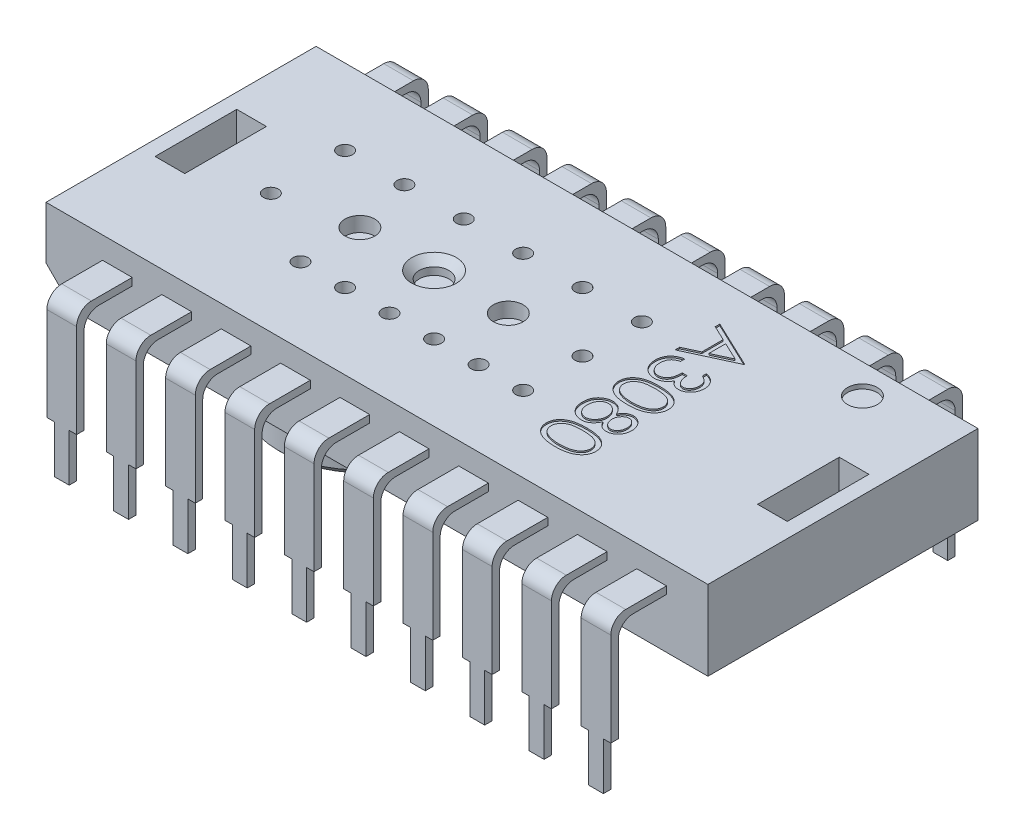
from build123d import *

# Parameters (mm, degrees)
SKETCH1_W           = 22.3
SKETCH1_H           = 9.1
BOSS_EXTRUDE1_DEPTH = 3.18
SKETCH2_R           = 2.8
SKETCH2_R_2         = 0.525
BOSS_EXTRUDE2_DEPTH = 2.25
BOSS_EXTRUDE2_DRAFT = 1.5
CHAMFER1_SIZE       = 0.3
CHAMFER1_SIZE2      = 0.308172622
SKETCH3_W           = 1
SKETCH3_H           = 1.875
BOSS_EXTRUDE3_DEPTH = 0.25
BOSS_EXTRUDE4_DEPTH = 0.25
BOSS_EXTRUDE5_DEPTH = 0.25
FILLET1_R           = 0.5
CUT_EXTRUDE1_DEPTH  = 27.146980705
SKETCH8_W           = 22.3
SKETCH8_H           = 9.1
SKETCH8_W_2         = 19.48
SKETCH8_H_2         = 7.28
CUT_EXTRUDE2_DEPTH  = 0.5
CHAMFER2_SIZE       = 0.91
CUT_EXTRUDE3_DEPTH  = 0.5
SKETCH11_R          = 0.5
CUT_EXTRUDE5_DEPTH  = 0.15
SKETCH13_R          = 0.5
SKETCH13_R_2        = 0.25
CUT_EXTRUDE6_DEPTH  = 0.5
CHAMFER3_SIZE       = 0.25
SKETCH14_W          = 1
SKETCH14_H          = 2.75
CUT_EXTRUDE7_DEPTH  = 1
CUT_EXTRUDE8_DEPTH  = 0.05
SKETCH16_W          = 19.5
SKETCH16_H          = 1.8
CUT_EXTRUDE9_DEPTH  = 27.146980791


with BuildPart() as part:
    # Sketch1 → Boss-Extrude1 (new body)
    with BuildSketch(Plane(origin=(0, 0, 0), x_dir=(1, 0, 0), z_dir=(0, 1, 0))):
        with Locations((11.15, 4.55)):
            Rectangle(SKETCH1_W, SKETCH1_H)
    extrude(amount=BOSS_EXTRUDE1_DEPTH)


with BuildPart() as boss_extrude2_tool:
    # Sketch2 → Boss-Extrude2 (with draft: the straight prism first)
    with BuildSketch(Plane(origin=(0, 0, 0), x_dir=(-1, 0, 0), z_dir=(0, -1, 0))):
        with Locations((-6.025, 4.55)):
            Circle(SKETCH2_R)
        with Locations((-6.025, 4.55)):
            Circle(SKETCH2_R_2, mode=Mode.SUBTRACT)
    extrude(amount=BOSS_EXTRUDE2_DEPTH)
    # Boss-Extrude2: the draft: its side faces are tilted about the plane it starts from
    boss_extrude2_sides = [boss_extrude2_tool.faces().sort_by_distance(p)[0] for p in [
        (8.825, -1.125, -4.55),
        (6.55, -1.125, -4.55),
    ]]
    draft(boss_extrude2_sides, Plane(origin=(0, 0, 0), x_dir=(-1, 0, 0), z_dir=(0, -1, 0)), BOSS_EXTRUDE2_DRAFT)


with BuildPart() as part_1:
    add(part.part)

    # Boss-Extrude2: add boss_extrude2_tool
    add(boss_extrude2_tool.part)

    # Chamfer1
    chamfer1_edges = [part_1.edges().sort_by_distance(p)[0] for p in [
        (8.766081676, -2.25, -4.55),
    ]]
    chamfer1_side = [part_1.faces().sort_by_distance(p)[0] for p in [
        (8.795540838, -1.125, -4.55),
    ]]
    chamfer(chamfer1_edges, length=CHAMFER1_SIZE, length2=CHAMFER1_SIZE2, reference=chamfer1_side[0])

    # Sketch3 → Boss-Extrude3 (add)
    with BuildSketch(Plane(origin=(0, 2.19, 0), x_dir=(1, 0, 0), z_dir=(0, 1, 0))):
        with Locations((19.405, 10.0375)):
            Rectangle(SKETCH3_W, SKETCH3_H)
        with Locations((17.405, 10.0375)):
            Rectangle(SKETCH3_W, SKETCH3_H)
        with Locations((15.405, 10.0375)):
            Rectangle(SKETCH3_W, SKETCH3_H)
        with Locations((13.405, 10.0375)):
            Rectangle(SKETCH3_W, SKETCH3_H)
        with Locations((11.405, 10.0375)):
            Rectangle(SKETCH3_W, SKETCH3_H)
        with Locations((9.405, 10.0375)):
            Rectangle(SKETCH3_W, SKETCH3_H)
        with Locations((7.405, 10.0375)):
            Rectangle(SKETCH3_W, SKETCH3_H)
        with Locations((5.405, 10.0375)):
            Rectangle(SKETCH3_W, SKETCH3_H)
        with Locations((3.405, 10.0375)):
            Rectangle(SKETCH3_W, SKETCH3_H)
        with Locations((1.405, 10.0375)):
            Rectangle(SKETCH3_W, SKETCH3_H)
        with Locations((20.405, -0.9375)):
            Rectangle(SKETCH3_W, SKETCH3_H)
        with Locations((18.405, -0.9375)):
            Rectangle(SKETCH3_W, SKETCH3_H)
        with Locations((16.405, -0.9375)):
            Rectangle(SKETCH3_W, SKETCH3_H)
        with Locations((14.405, -0.9375)):
            Rectangle(SKETCH3_W, SKETCH3_H)
        with Locations((12.405, -0.9375)):
            Rectangle(SKETCH3_W, SKETCH3_H)
        with Locations((10.405, -0.9375)):
            Rectangle(SKETCH3_W, SKETCH3_H)
        with Locations((8.405, -0.9375)):
            Rectangle(SKETCH3_W, SKETCH3_H)
        with Locations((6.405, -0.9375)):
            Rectangle(SKETCH3_W, SKETCH3_H)
        with Locations((4.405, -0.9375)):
            Rectangle(SKETCH3_W, SKETCH3_H)
        with Locations((2.405, -0.9375)):
            Rectangle(SKETCH3_W, SKETCH3_H)
    extrude(amount=BOSS_EXTRUDE3_DEPTH)

    # Sketch5 → Boss-Extrude4 (add)
    with BuildSketch(Plane.XY.offset(1.875)):
        Polygon((1.905, 2.19), (2.905, 2.19), (2.905, -1.21), (2.655, -1.21), (2.655, -4.61), (2.155, -4.61), (2.155, -1.21), (1.905, -1.21), align=None)
        Polygon((3.905, 2.19), (4.905, 2.19), (4.905, -1.21), (4.655, -1.21), (4.655, -4.61), (4.155, -4.61), (4.155, -1.21), (3.905, -1.21), align=None)
        Polygon((5.905, 2.19), (6.905, 2.19), (6.905, -1.21), (6.655, -1.21), (6.655, -4.61), (6.155, -4.61), (6.155, -1.21), (5.905, -1.21), align=None)
        Polygon((7.905, 2.19), (8.905, 2.19), (8.905, -1.21), (8.655, -1.21), (8.655, -4.61), (8.155, -4.61), (8.155, -1.21), (7.905, -1.21), align=None)
        Polygon((9.905, 2.19), (10.905, 2.19), (10.905, -1.21), (10.655, -1.21), (10.655, -4.61), (10.155, -4.61), (10.155, -1.21), (9.905, -1.21), align=None)
        Polygon((11.905, 2.19), (12.905, 2.19), (12.905, -1.21), (12.655, -1.21), (12.655, -4.61), (12.155, -4.61), (12.155, -1.21), (11.905, -1.21), align=None)
        Polygon((13.905, 2.19), (14.905, 2.19), (14.905, -1.21), (14.655, -1.21), (14.655, -4.61), (14.155, -4.61), (14.155, -1.21), (13.905, -1.21), align=None)
        Polygon((15.905, 2.19), (16.905, 2.19), (16.905, -1.21), (16.655, -1.21), (16.655, -4.61), (16.155, -4.61), (16.155, -1.21), (15.905, -1.21), align=None)
        Polygon((17.905, 2.19), (18.905, 2.19), (18.905, -1.21), (18.655, -1.21), (18.655, -4.61), (18.155, -4.61), (18.155, -1.21), (17.905, -1.21), align=None)
        Polygon((19.905, 2.19), (20.905, 2.19), (20.905, -1.21), (20.655, -1.21), (20.655, -4.61), (20.155, -4.61), (20.155, -1.21), (19.905, -1.21), align=None)
    extrude(amount=-BOSS_EXTRUDE4_DEPTH)

    # Sketch6 → Boss-Extrude5 (add)
    with BuildSketch(Plane(origin=(0, 0, -10.975), x_dir=(-1, 0, 0), z_dir=(0, 0, -1))):
        Polygon((-19.905, 2.19), (-19.905, -1.21), (-19.655, -1.21), (-19.655, -4.61), (-19.155, -4.61), (-19.155, -1.21), (-18.905, -1.21), (-18.905, 2.19), align=None)
        Polygon((-17.905, 2.19), (-17.905, -1.21), (-17.655, -1.21), (-17.655, -4.61), (-17.155, -4.61), (-17.155, -1.21), (-16.905, -1.21), (-16.905, 2.19), align=None)
        Polygon((-15.905, 2.19), (-15.905, -1.21), (-15.655, -1.21), (-15.655, -4.61), (-15.155, -4.61), (-15.155, -1.21), (-14.905, -1.21), (-14.905, 2.19), align=None)
        Polygon((-13.905, 2.19), (-13.905, -1.21), (-13.655, -1.21), (-13.655, -4.61), (-13.155, -4.61), (-13.155, -1.21), (-12.905, -1.21), (-12.905, 2.19), align=None)
        Polygon((-11.905, 2.19), (-11.905, -1.21), (-11.655, -1.21), (-11.655, -4.61), (-11.155, -4.61), (-11.155, -1.21), (-10.905, -1.21), (-10.905, 2.19), align=None)
        Polygon((-9.905, 2.19), (-9.905, -1.21), (-9.655, -1.21), (-9.655, -4.61), (-9.155, -4.61), (-9.155, -1.21), (-8.905, -1.21), (-8.905, 2.19), align=None)
        Polygon((-7.905, 2.19), (-7.905, -1.21), (-7.655, -1.21), (-7.655, -4.61), (-7.155, -4.61), (-7.155, -1.21), (-6.905, -1.21), (-6.905, 2.19), align=None)
        Polygon((-5.905, 2.19), (-5.905, -1.21), (-5.655, -1.21), (-5.655, -4.61), (-5.155, -4.61), (-5.155, -1.21), (-4.905, -1.21), (-4.905, 2.19), align=None)
        Polygon((-3.905, 2.19), (-3.905, -1.21), (-3.655, -1.21), (-3.655, -4.61), (-3.155, -4.61), (-3.155, -1.21), (-2.905, -1.21), (-2.905, 2.19), align=None)
        Polygon((-1.905, 2.19), (-1.905, -1.21), (-1.655, -1.21), (-1.655, -4.61), (-1.155, -4.61), (-1.155, -1.21), (-0.905, -1.21), (-0.905, 2.19), align=None)
    extrude(amount=-BOSS_EXTRUDE5_DEPTH)

    # Fillet1
    fillet1_edges = [part_1.edges().sort_by_distance(p)[0] for p in [
        (7.405, 2.44, -10.975),
        (5.405, 2.44, -10.975),
        (3.405, 2.44, -10.975),
        (1.405, 2.44, -10.975),
        (18.405, 2.44, 1.875),
        (16.405, 2.44, 1.875),
        (14.405, 2.44, 1.875),
        (12.405, 2.44, 1.875),
        (10.405, 2.44, 1.875),
        (8.405, 2.44, 1.875),
        (6.405, 2.44, 1.875),
        (4.405, 2.44, 1.875),
        (2.405, 2.44, 1.875),
        (2.405, 2.19, 1.625),
        (4.405, 2.19, 1.625),
        (6.405, 2.19, 1.625),
        (19.405, 2.44, -10.975),
        (8.405, 2.19, 1.625),
        (10.405, 2.19, 1.625),
        (12.405, 2.19, 1.625),
        (14.405, 2.19, 1.625),
        (16.405, 2.19, 1.625),
        (18.405, 2.19, 1.625),
        (20.405, 2.44, 1.875),
        (20.405, 2.19, 1.625),
        (19.405, 2.19, -10.725),
        (17.405, 2.19, -10.725),
        (17.405, 2.44, -10.975),
        (15.405, 2.19, -10.725),
        (13.405, 2.19, -10.725),
        (11.405, 2.19, -10.725),
        (9.405, 2.19, -10.725),
        (7.405, 2.19, -10.725),
        (5.405, 2.19, -10.725),
        (15.405, 2.44, -10.975),
        (3.405, 2.19, -10.725),
        (1.405, 2.19, -10.725),
        (13.405, 2.44, -10.975),
        (11.405, 2.44, -10.975),
        (9.405, 2.44, -10.975),
    ]]
    fillet(fillet1_edges, radius=FILLET1_R)

    # Sketch7 → Cut-Extrude1 (cut, through all)
    with BuildSketch(Plane.XY.offset(-10.975)):
        Polygon((1.53, -4.61), (1.655, -3.61), (1.655, -4.61), align=None)
        Polygon((1.28, -4.61), (1.155, -3.61), (1.155, -4.61), align=None)
        Polygon((2.53, -4.61), (2.655, -3.61), (2.655, -4.61), align=None)
        Polygon((2.28, -4.61), (2.155, -3.61), (2.155, -4.61), align=None)
        Polygon((3.53, -4.61), (3.655, -3.61), (3.655, -4.61), align=None)
        Polygon((3.28, -4.61), (3.155, -3.61), (3.155, -4.61), align=None)
        Polygon((4.53, -4.61), (4.655, -3.61), (4.655, -4.61), align=None)
        Polygon((4.28, -4.61), (4.155, -3.61), (4.155, -4.61), align=None)
        Polygon((5.53, -4.61), (5.655, -3.61), (5.655, -4.61), align=None)
        Polygon((5.28, -4.61), (5.155, -3.61), (5.155, -4.61), align=None)
        Polygon((6.53, -4.61), (6.655, -3.61), (6.655, -4.61), align=None)
        Polygon((6.28, -4.61), (6.155, -3.61), (6.155, -4.61), align=None)
        Polygon((7.53, -4.61), (7.655, -3.61), (7.655, -4.61), align=None)
        Polygon((7.28, -4.61), (7.155, -3.61), (7.155, -4.61), align=None)
        Polygon((8.53, -4.61), (8.655, -3.61), (8.655, -4.61), align=None)
        Polygon((8.28, -4.61), (8.155, -3.61), (8.155, -4.61), align=None)
        Polygon((9.53, -4.61), (9.655, -3.61), (9.655, -4.61), align=None)
        Polygon((9.28, -4.61), (9.155, -3.61), (9.155, -4.61), align=None)
        Polygon((10.53, -4.61), (10.655, -3.61), (10.655, -4.61), align=None)
        Polygon((10.28, -4.61), (10.155, -3.61), (10.155, -4.61), align=None)
        Polygon((11.53, -4.61), (11.655, -3.61), (11.655, -4.61), align=None)
        Polygon((11.28, -4.61), (11.155, -3.61), (11.155, -4.61), align=None)
        Polygon((12.53, -4.61), (12.655, -3.61), (12.655, -4.61), align=None)
        Polygon((12.28, -4.61), (12.155, -3.61), (12.155, -4.61), align=None)
        Polygon((13.53, -4.61), (13.655, -3.61), (13.655, -4.61), align=None)
        Polygon((13.28, -4.61), (13.155, -3.61), (13.155, -4.61), align=None)
        Polygon((14.53, -4.61), (14.655, -3.61), (14.655, -4.61), align=None)
        Polygon((14.28, -4.61), (14.155, -3.61), (14.155, -4.61), align=None)
        Polygon((15.53, -4.61), (15.655, -3.61), (15.655, -4.61), align=None)
        Polygon((15.28, -4.61), (15.155, -3.61), (15.155, -4.61), align=None)
        Polygon((16.53, -4.61), (16.655, -3.61), (16.655, -4.61), align=None)
        Polygon((16.28, -4.61), (16.155, -3.61), (16.155, -4.61), align=None)
        Polygon((17.53, -4.61), (17.655, -3.61), (17.655, -4.61), align=None)
        Polygon((17.28, -4.61), (17.155, -3.61), (17.155, -4.61), align=None)
        Polygon((18.53, -4.61), (18.655, -3.61), (18.655, -4.61), align=None)
        Polygon((18.28, -4.61), (18.155, -3.61), (18.155, -4.61), align=None)
        Polygon((19.53, -4.61), (19.655, -3.61), (19.655, -4.61), align=None)
        Polygon((19.28, -4.61), (19.155, -3.61), (19.155, -4.61), align=None)
        Polygon((20.53, -4.61), (20.655, -3.61), (20.655, -4.61), align=None)
        Polygon((20.28, -4.61), (20.155, -3.61), (20.155, -4.61), align=None)
    extrude(amount=CUT_EXTRUDE1_DEPTH, mode=Mode.SUBTRACT)

    # Sketch8 → Cut-Extrude2 (cut)
    with BuildSketch(Plane(origin=(0, 0, 0), x_dir=(-1, 0, 0), z_dir=(0, -1, 0))):
        with Locations((-11.15, 4.55)):
            Rectangle(SKETCH8_W, SKETCH8_H)
        with Locations((-11.15, 4.55)):
            Rectangle(SKETCH8_W_2, SKETCH8_H_2, mode=Mode.SUBTRACT)
    extrude(amount=-CUT_EXTRUDE2_DEPTH, mode=Mode.SUBTRACT)

    # Chamfer2
    chamfer2_edges = [part_1.edges().sort_by_distance(p)[0] for p in [
        (0, 0.5, -4.55),
    ]]
    chamfer(chamfer2_edges, length=CHAMFER2_SIZE)

    # Sketch9 → Cut-Extrude3 (cut)
    with BuildSketch(Plane(origin=(0, 0, 0), x_dir=(-1, 0, 0), z_dir=(0, -1, 0))):
        with BuildLine():
            Line((-1.41, 3.05), (-1.41, 6.05))
            ThreePointArc((-1.41, 6.05), (-2.117106781, 5.757106781), (-2.41, 5.05))
            Line((-2.41, 5.05), (-2.41, 4.05))
            ThreePointArc((-2.41, 4.05), (-2.117106781, 3.342893219), (-1.41, 3.05))
        make_face()
    extrude(amount=-CUT_EXTRUDE3_DEPTH, mode=Mode.SUBTRACT)

    # Sketch11 → Cut-Extrude5 (cut)
    with BuildSketch(Plane(origin=(0, 3.18, 0), x_dir=(1, 0, 0), z_dir=(0, 1, 0))):
        with Locations(Location((19.405, 8.1, 0), (0, 0, 270))):
            Circle(SKETCH11_R)
    extrude(amount=-CUT_EXTRUDE5_DEPTH, mode=Mode.SUBTRACT)

    # Sketch13 → Cut-Extrude6 (cut)
    with BuildSketch(Plane(origin=(0, 3.18, 0), x_dir=(1, 0, 0), z_dir=(0, 1, 0))):
        with Locations(Location((6.025, 4.55, 0), (0, 0, 270))):
            Circle(SKETCH13_R)
        with Locations(Location((8.525, 4.55, 0), (0, 0, 270))):
            Circle(SKETCH13_R)
        with Locations(Location((11.025, 4.55, 0), (0, 0, 270))):
            Circle(SKETCH13_R)
        with Locations(Location((3.525, 6.55, 0), (0, 0, 270))):
            Circle(SKETCH13_R_2)
        with Locations(Location((5.525, 6.55, 0), (0, 0, 270))):
            Circle(SKETCH13_R_2)
        with Locations(Location((7.525, 6.55, 0), (0, 0, 270))):
            Circle(SKETCH13_R_2)
        with Locations(Location((9.525, 6.55, 0), (0, 0, 270))):
            Circle(SKETCH13_R_2)
        with Locations(Location((11.525, 6.55, 0), (0, 0, 270))):
            Circle(SKETCH13_R_2)
        with Locations(Location((13.525, 6.55, 0), (0, 0, 270))):
            Circle(SKETCH13_R_2)
        with Locations(Location((13.525, 4.55, 0), (0, 0, 270))):
            Circle(SKETCH13_R_2)
        with Locations(Location((13.525, 2.55, 0), (0, 0, 270))):
            Circle(SKETCH13_R_2)
        with Locations(Location((12.025, 2.55, 0), (0, 0, 270))):
            Circle(SKETCH13_R_2)
        with Locations(Location((10.525, 2.55, 0), (0, 0, 270))):
            Circle(SKETCH13_R_2)
        with Locations(Location((9.025, 2.55, 0), (0, 0, 270))):
            Circle(SKETCH13_R_2)
        with Locations(Location((7.525, 2.55, 0), (0, 0, 270))):
            Circle(SKETCH13_R_2)
        with Locations(Location((6.025, 2.55, 0), (0, 0, 270))):
            Circle(SKETCH13_R_2)
        with Locations(Location((3.525, 4.05, 0), (0, 0, 270))):
            Circle(SKETCH13_R_2)
    extrude(amount=-CUT_EXTRUDE6_DEPTH, mode=Mode.SUBTRACT)

    # Chamfer3
    chamfer3_edges = [part_1.edges().sort_by_distance(p)[0] for p in [
        (8.525, 3.18, -5.05),
    ]]
    chamfer(chamfer3_edges, length=CHAMFER3_SIZE)

    # Sketch14 → Cut-Extrude7 (cut)
    with BuildSketch(Plane(origin=(0, 3.18, 0), x_dir=(1, 0, 0), z_dir=(0, 1, 0))):
        with Locations((1, 4.55)):
            Rectangle(SKETCH14_W, SKETCH14_H)
        with Locations((21.3, 4.55)):
            Rectangle(SKETCH14_W, SKETCH14_H)
    extrude(amount=-CUT_EXTRUDE7_DEPTH, mode=Mode.SUBTRACT)

    # Sketch15 → Cut-Extrude8 (cut)
    # profile 1 of 5: a face of its own
    with BuildSketch(Plane(origin=(0, 3.18, 0), x_dir=(1, 0, 0), z_dir=(0, 1, 0))):
        Polygon((16.4925, 7.024038462), (14.905, 6.291346154), (14.905, 6.446216446), (15.413814103, 6.680906951), (15.413814103, 7.400560897), (14.905, 7.641929587), (14.905, 7.797435897), (16.4925, 7.044391026), align=None)
        Polygon((16.183077424, 7.035804788), (15.576634615, 7.323284756), (15.576634615, 6.755957031), align=None, mode=Mode.SUBTRACT)
    # profile 2 of 5: a face of its own
    with BuildSketch(Plane(origin=(0, 3.18, 0), x_dir=(1, 0, 0), z_dir=(0, 1, 0))):
        with BuildLine():
            Line((16.126153846, 5.986057692), (16.126153846, 6.128525641))
            add(Edge.make_bspline(
                [(16.126153846, 6.128525641), (16.142134294, 6.124665952), (16.173374763, 6.117120576), (16.218009485, 6.101382748), (16.260247654, 6.084238085), (16.299298373, 6.063650884), (16.335946447, 6.041195128), (16.369360657, 6.015467322), (16.400390823, 5.987654448), (16.427928613, 5.956890989), (16.45286494, 5.92462906), (16.474126127, 5.890414072), (16.49241601, 5.854934402), (16.507483759, 5.817944231), (16.518834621, 5.779333432), (16.527070029, 5.739451067), (16.532418142, 5.698192622), (16.532940095, 5.67018568), (16.533205128, 5.655964543)],
                knots=[0, 0, 0, 0, 1.162005537, 2.271625781, 3.343758855, 4.383309926, 5.390229558, 6.379919256, 7.361854164, 8.333198761, 9.295911338, 10.242430842, 11.177959212, 12.116337295, 13.062827104, 14.020064771, 14.994644689, 16, 16, 16, 16], degree=3))
            add(Edge.make_bspline(
                [(16.533205128, 5.655964543), (16.532579549, 5.635244157), (16.531342036, 5.594255355), (16.520041559, 5.53403783), (16.502159445, 5.475968523), (16.477451719, 5.420683043), (16.446977474, 5.369330397), (16.410707754, 5.323639341), (16.369342356, 5.284229195), (16.323652943, 5.251166388), (16.27482348, 5.225278799), (16.224567694, 5.206189622), (16.1730048, 5.19456836), (16.138189891, 5.19306225), (16.120747696, 5.192307692)],
                knots=[0, 0, 0, 0, 1.083050992, 2.142477498, 3.193116406, 4.255571735, 5.30263384, 6.308962982, 7.297363603, 8.282367274, 9.249857812, 10.179914175, 11.08814088, 12, 12, 12, 12], degree=3))
            add(Edge.make_bspline(
                [(16.120747696, 5.192307692), (16.103962472, 5.192835464), (16.071116392, 5.193868231), (16.023164141, 5.202637448), (15.977969558, 5.217394967), (15.935342388, 5.237837323), (15.895552907, 5.264299384), (15.858511592, 5.2963545), (15.824054153, 5.334228921), (15.804314963, 5.36293044), (15.794152644, 5.377706831)],
                knots=[0, 0, 0, 0, 1.024540389, 2.004866551, 2.965041327, 3.920577974, 4.882998113, 5.874504559, 6.905732034, 8, 8, 8, 8], degree=3))
            add(Edge.make_bspline(
                [(15.794152644, 5.377706831), (15.785998259, 5.360819571), (15.769842064, 5.327361024), (15.738157488, 5.281754177), (15.701574074, 5.240353141), (15.673025085, 5.217264668), (15.658680889, 5.205664062)],
                knots=[0, 0, 0, 0, 1.015518401, 2.012035669, 3.001164323, 4, 4, 4, 4], degree=3))
            add(Edge.make_bspline(
                [(15.658680889, 5.205664062), (15.648223667, 5.198022201), (15.627480465, 5.18286362), (15.594110161, 5.164205787), (15.560480456, 5.147085967), (15.525269074, 5.134486276), (15.489607067, 5.123613241), (15.452730768, 5.116459146), (15.414990535, 5.111866504), (15.389446887, 5.111221603), (15.376607071, 5.110897436)],
                knots=[0, 0, 0, 0, 1.02516404, 2.033540309, 3.025129118, 4.011046665, 4.991655828, 5.976607087, 6.982917762, 8, 8, 8, 8], degree=3))
            add(Edge.make_bspline(
                [(15.376607071, 5.110897436), (15.354378546, 5.111713168), (15.310026103, 5.113340794), (15.244483238, 5.127830044), (15.180524796, 5.150421867), (15.119098432, 5.181943207), (15.061745877, 5.220943386), (15.010663742, 5.267599106), (14.966459163, 5.320776176), (14.929644291, 5.380126562), (14.900193981, 5.444399758), (14.87975868, 5.513151651), (14.866447773, 5.585382508), (14.865020499, 5.634915875), (14.864294872, 5.660098658)],
                knots=[0, 0, 0, 0, 0.95570045, 1.906903359, 2.87519758, 3.868912786, 4.869932978, 5.851730567, 6.836639976, 7.83677598, 8.849487602, 9.869908895, 10.917060885, 12, 12, 12, 12], degree=3))
            add(Edge.make_bspline(
                [(14.864294872, 5.660098658), (14.864688669, 5.677070983), (14.865463529, 5.71046686), (14.870760609, 5.759563018), (14.88043529, 5.806426789), (14.893454289, 5.851121535), (14.909960544, 5.893686963), (14.93051581, 5.933993182), (14.954696384, 5.972288169), (14.98278769, 6.008210551), (15.014211726, 6.041756044), (15.049526349, 6.072033172), (15.088078743, 6.099546721), (15.1303167, 6.12355999), (15.175694371, 6.14516675), (15.224792797, 6.162938113), (15.27717305, 6.178579781), (15.313675453, 6.185852103), (15.332403846, 6.189583333)],
                knots=[0, 0, 0, 0, 1.048658725, 2.063410685, 3.046034179, 4.001477787, 4.936774919, 5.862367409, 6.792675028, 7.730719943, 8.675894397, 9.627829632, 10.600096036, 11.597688215, 12.626045268, 13.701542398, 14.82072376, 16, 16, 16, 16], degree=3))
            Line((15.332403846, 6.189583333), (15.332403846, 6.047115385))
            add(Edge.make_bspline(
                [(15.332403846, 6.047115385), (15.320180544, 6.043403677), (15.296405159, 6.036184085), (15.262187592, 6.023894885), (15.230819475, 6.009893919), (15.202070701, 5.994874101), (15.175658147, 5.979099592), (15.152280228, 5.961448894), (15.130910119, 5.943229317), (15.118870241, 5.929495467), (15.112977764, 5.922773938)],
                knots=[0, 0, 0, 0, 1.198163088, 2.33053128, 3.407730985, 4.417276592, 5.372219308, 6.28897303, 7.162600585, 8, 8, 8, 8], degree=3))
            add(Edge.make_bspline(
                [(15.112977764, 5.922773938), (15.106125056, 5.913885491), (15.092440791, 5.896136033), (15.074977553, 5.867212586), (15.059845945, 5.836793869), (15.048287269, 5.804220785), (15.038500258, 5.770196228), (15.032095594, 5.734170245), (15.027701316, 5.696460671), (15.027313544, 5.670712436), (15.027115385, 5.657554587)],
                knots=[0, 0, 0, 0, 0.946170439, 1.889420265, 2.845303464, 3.807233317, 4.801018734, 5.828864929, 6.890507805, 8, 8, 8, 8], degree=3))
            add(Edge.make_bspline(
                [(15.027115385, 5.657554587), (15.027394287, 5.642698333), (15.027939657, 5.613648211), (15.032969629, 5.571262566), (15.040263244, 5.53092665), (15.051671877, 5.493052089), (15.065358417, 5.457123504), (15.083276609, 5.423942925), (15.10351231, 5.392534884), (15.127050322, 5.36381949), (15.152492366, 5.337931159), (15.179484107, 5.315560781), (15.207188626, 5.296185475), (15.236252213, 5.280610962), (15.266389777, 5.268290792), (15.297714125, 5.259908797), (15.329961484, 5.254079329), (15.351882168, 5.253604668), (15.362932692, 5.253365385)],
                knots=[0, 0, 0, 0, 1.216990249, 2.379719373, 3.493992396, 4.571561497, 5.616923107, 6.638958652, 7.655775068, 8.674704564, 9.676001865, 10.625896028, 11.54399481, 12.441854662, 13.322657739, 14.20572845, 15.095482574, 16, 16, 16, 16], degree=3))
            add(Edge.make_bspline(
                [(15.362932692, 5.253365385), (15.377724281, 5.254059473), (15.407233856, 5.255444197), (15.450648363, 5.266016487), (15.492479244, 5.283405181), (15.532006794, 5.307752319), (15.568659066, 5.337375952), (15.601233951, 5.371989323), (15.62838324, 5.411677338), (15.647071792, 5.448440517), (15.659526925, 5.481082693), (15.668260232, 5.508961706), (15.675241483, 5.54020072), (15.681994455, 5.574424717), (15.687655718, 5.611778038), (15.692397247, 5.652294335), (15.696185256, 5.695989908), (15.697877803, 5.726239054), (15.69875, 5.741826923)],
                knots=[0, 0, 0, 0, 1.070481957, 2.135637345, 3.216366529, 4.339485895, 5.485746587, 6.620975969, 7.768829582, 8.956804399, 9.598399438, 10.297751078, 11.070570279, 11.915248466, 12.824061284, 13.805856426, 14.869322739, 16, 16, 16, 16], degree=3))
            Line((15.69875, 5.741826923), (15.861570513, 5.741826923))
            add(Edge.make_bspline(
                [(15.861570513, 5.741826923), (15.861905252, 5.722187294), (15.862560924, 5.683718086), (15.870436244, 5.627515528), (15.88145278, 5.573708221), (15.897937562, 5.523524379), (15.917724005, 5.477932735), (15.940034664, 5.438161166), (15.965311641, 5.405152242), (15.993223197, 5.378823493), (16.023508241, 5.359499126), (16.054742756, 5.344994274), (16.087653465, 5.336490943), (16.110100708, 5.335349421), (16.121383714, 5.334775641)],
                knots=[0, 0, 0, 0, 1.321708579, 2.588902423, 3.815526512, 5.016621128, 6.138757764, 7.158873101, 8.079948563, 8.928590313, 9.728601868, 10.489025425, 11.240515403, 12, 12, 12, 12], degree=3))
            add(Edge.make_bspline(
                [(16.121383714, 5.334775641), (16.129673997, 5.334963584), (16.146167122, 5.335337488), (16.170262842, 5.340053717), (16.193623292, 5.347139137), (16.216142474, 5.35688632), (16.237689676, 5.369908975), (16.258291334, 5.385540498), (16.278292709, 5.403788435), (16.296736911, 5.425129696), (16.314134517, 5.448233886), (16.3291741, 5.473318402), (16.341921641, 5.499829975), (16.352453827, 5.527792983), (16.360371479, 5.557319446), (16.366057766, 5.588264786), (16.369612594, 5.620689634), (16.370124426, 5.642811087), (16.370384615, 5.65405649)],
                knots=[0, 0, 0, 0, 0.884317272, 1.759307272, 2.611736065, 3.488921043, 4.37244062, 5.294096728, 6.247679003, 7.258495569, 8.302441962, 9.333537773, 10.376747089, 11.440883505, 12.520330301, 13.637364711, 14.798958396, 16, 16, 16, 16], degree=3))
            add(Edge.make_bspline(
                [(16.370384615, 5.65405649), (16.369754757, 5.672132666), (16.368524498, 5.70743964), (16.357711076, 5.758328798), (16.340578323, 5.805588323), (16.319890575, 5.841590547), (16.299539373, 5.868220971), (16.282031234, 5.887615672), (16.26218059, 5.906314151), (16.23944296, 5.923582662), (16.214600201, 5.940455971), (16.187515486, 5.956772963), (16.157802669, 5.972009536), (16.13690776, 5.981284287), (16.126153846, 5.986057692)],
                knots=[0, 0, 0, 0, 1.4727372, 2.876598283, 4.222346151, 5.558423782, 6.24313385, 6.953189256, 7.68715613, 8.463578749, 9.278833271, 10.135787152, 11.040551781, 12, 12, 12, 12], degree=3))
        make_face()
    # profile 3 of 5: a face of its own
    with BuildSketch(Plane(origin=(0, 3.18, 0), x_dir=(1, 0, 0), z_dir=(0, 1, 0))):
        with BuildLine():
            add(Edge.make_bspline(
                [(15.698113982, 4.968429487), (15.723558155, 4.968280708), (15.772983826, 4.967991701), (15.845004003, 4.964776596), (15.912568134, 4.959435637), (15.975679453, 4.952116185), (16.034354256, 4.943208962), (16.088435724, 4.931318353), (16.138174228, 4.917796161), (16.183731737, 4.902124012), (16.225722802, 4.884440772), (16.264921166, 4.865192013), (16.301277064, 4.843624331), (16.335336659, 4.820933531), (16.366719828, 4.79629043), (16.39536714, 4.769954953), (16.421295893, 4.741665862), (16.444814682, 4.711982651), (16.465302546, 4.68071773), (16.483763473, 4.648834892), (16.498915485, 4.61577154), (16.511365576, 4.581829221), (16.521341519, 4.547106644), (16.52824984, 4.511460336), (16.5325795, 4.474881687), (16.532994607, 4.450193421), (16.533205128, 4.437672776)],
                knots=[0, 0, 0, 0, 1.646377244, 3.198111528, 4.663803227, 6.031090796, 7.308794487, 8.502186765, 9.612154809, 10.642545331, 11.617106989, 12.558866172, 13.465886467, 14.35053239, 15.20542558, 16.045215227, 16.865619885, 17.686225247, 18.492864914, 19.282407821, 20.068097601, 20.842842034, 21.620163247, 22.403093475, 23.190129512, 24, 24, 24, 24], degree=3))
            add(Edge.make_bspline(
                [(16.533205128, 4.437672776), (16.532983869, 4.425047399), (16.532543855, 4.399939495), (16.528314781, 4.362819039), (16.521297521, 4.326556147), (16.511354793, 4.29130542), (16.499019612, 4.256777301), (16.483558669, 4.223241859), (16.465561469, 4.19049079), (16.44441421, 4.159044553), (16.420836535, 4.128557923), (16.394183467, 4.09977974), (16.36472413, 4.072707383), (16.332773713, 4.047001084), (16.297719407, 4.023390153), (16.2601709, 4.00090506), (16.219471543, 3.980779172), (16.176300403, 3.961395945), (16.129462957, 3.944665062), (16.079223227, 3.929576443), (16.024987792, 3.917384911), (15.967041209, 3.907229777), (15.905170672, 3.899362627), (15.839508808, 3.893632822), (15.770012416, 3.890606101), (15.722497249, 3.890036097), (15.698113982, 3.88974359)],
                knots=[0, 0, 0, 0, 0.810914788, 1.612654377, 2.396697861, 3.181598691, 3.963628158, 4.749916497, 5.551656086, 6.361998678, 7.18212741, 8.025565596, 8.878627764, 9.750805457, 10.657531673, 11.591944965, 12.560506719, 13.57287815, 14.630710178, 15.753379473, 16.941251878, 18.199788006, 19.531962791, 20.947069417, 22.433333509, 24, 24, 24, 24], degree=3))
            add(Edge.make_bspline(
                [(15.698113982, 3.88974359), (15.673837158, 3.890039495), (15.626534755, 3.890616055), (15.557349809, 3.893594922), (15.492040816, 3.899490316), (15.430425983, 3.906781989), (15.372871135, 3.917168876), (15.318828997, 3.928976937), (15.268765942, 3.943653088), (15.222175513, 3.960155929), (15.179215883, 3.97911856), (15.138868353, 3.999422323), (15.101350485, 4.021769397), (15.066296688, 4.045521139), (15.034069178, 4.071008938), (15.004588306, 4.09819593), (14.977873516, 4.12710281), (14.953973696, 4.157658366), (14.933072606, 4.189599297), (14.914390394, 4.222241047), (14.899230937, 4.256235116), (14.886431514, 4.290826014), (14.876465912, 4.326340127), (14.869642532, 4.362742622), (14.864843773, 4.399914282), (14.864478472, 4.425043031), (14.864294872, 4.437672776)],
                knots=[0, 0, 0, 0, 1.56130642, 3.042141888, 4.451772327, 5.777565838, 7.030558081, 8.211376819, 9.333164717, 10.383253789, 11.387583522, 12.350962576, 13.286244149, 14.193812918, 15.072134482, 15.925989337, 16.770211267, 17.600669898, 18.417446232, 19.22325363, 20.01647746, 20.807971184, 21.593601364, 22.38506573, 23.188331689, 24, 24, 24, 24], degree=3))
            add(Edge.make_bspline(
                [(14.864294872, 4.437672776), (14.864507419, 4.450192912), (14.864926521, 4.474880175), (14.86922692, 4.511466172), (14.876239421, 4.547056885), (14.885762363, 4.581723464), (14.897865458, 4.615536855), (14.913260146, 4.648165822), (14.93111559, 4.680041282), (14.951429498, 4.711017785), (14.974708708, 4.740504939), (15.000454823, 4.768671687), (15.029313608, 4.79480683), (15.060823134, 4.819141074), (15.094716042, 4.84223295), (15.131326202, 4.863589285), (15.170891832, 4.882800498), (15.213114701, 4.900880034), (15.259007035, 4.91681711), (15.309010824, 4.930788456), (15.363402678, 4.942435527), (15.422021124, 4.951802162), (15.484910036, 4.95952401), (15.552180141, 4.964751305), (15.6237734, 4.967994261), (15.672881592, 4.968281765), (15.698113982, 4.968429487)],
                knots=[0, 0, 0, 0, 0.810940842, 1.599017053, 2.38298203, 3.159479784, 3.926441347, 4.70693857, 5.494146311, 6.292334103, 7.104379492, 7.925868426, 8.762126819, 9.623561095, 10.503686106, 11.41783325, 12.366995289, 13.351843594, 14.392337808, 15.512229747, 16.713911458, 17.994391108, 19.357476964, 20.818259213, 22.365182633, 24, 24, 24, 24], degree=3))
        make_face()
        with BuildLine():
            add(Edge.make_bspline(
                [(15.69875, 4.825961538), (15.677546126, 4.825907361), (15.63639357, 4.825802212), (15.576593234, 4.823055293), (15.520817406, 4.819313223), (15.468995267, 4.814486634), (15.421302222, 4.807318872), (15.377410271, 4.799287565), (15.337551626, 4.789514014), (15.301453006, 4.777950049), (15.268500996, 4.764779266), (15.237840651, 4.750396571), (15.209100239, 4.734954044), (15.182571667, 4.717641334), (15.157990864, 4.69885113), (15.135428467, 4.678552578), (15.114982921, 4.656781376), (15.090722299, 4.626642896), (15.065355633, 4.587050433), (15.043538363, 4.536909547), (15.02973887, 4.485365062), (15.027988866, 4.450369843), (15.027115385, 4.432902644)],
                knots=[0, 0, 0, 0, 1.459116078, 2.831857795, 4.118796693, 5.306371758, 6.412361096, 7.436813035, 8.376339383, 9.234574298, 10.043323891, 10.816788787, 11.564361537, 12.286735248, 12.994408768, 13.691741332, 14.372975427, 15.047457468, 16.352811911, 17.594285292, 18.799233213, 20, 20, 20, 20], degree=3))
            add(Edge.make_bspline(
                [(15.027115385, 4.432902644), (15.027840092, 4.415323272), (15.029288012, 4.380200822), (15.043257439, 4.328886564), (15.064334694, 4.279070692), (15.089257313, 4.240030919), (15.112991948, 4.210329908), (15.133227878, 4.189049702), (15.155886432, 4.169517987), (15.180333612, 4.150993189), (15.207036489, 4.134002823), (15.235866657, 4.118552756), (15.266904177, 4.104454238), (15.288571166, 4.096421921), (15.299648938, 4.092315204)],
                knots=[0, 0, 0, 0, 1.353760809, 2.704726607, 4.075137775, 5.516104923, 6.260822281, 7.007110065, 7.778089737, 8.566572457, 9.372053459, 10.217411131, 11.088608312, 12, 12, 12, 12], degree=3))
            add(Edge.make_bspline(
                [(15.299648938, 4.092315204), (15.313813856, 4.087529224), (15.342574713, 4.077811631), (15.387189655, 4.065287719), (15.43399948, 4.055424628), (15.482724444, 4.046551244), (15.53372388, 4.040494679), (15.58683999, 4.035619778), (15.642112822, 4.032748359), (15.679666264, 4.032392419), (15.69875, 4.032211538)],
                knots=[0, 0, 0, 0, 0.884706709, 1.796334032, 2.740027952, 3.714592787, 4.726048262, 5.777819803, 6.87074269, 8, 8, 8, 8], degree=3))
            add(Edge.make_bspline(
                [(15.69875, 4.032211538), (15.717833325, 4.03241103), (15.755169007, 4.032801327), (15.809791144, 4.03536561), (15.86176106, 4.0394862), (15.9111259, 4.045063329), (15.957797802, 4.052719547), (16.001843552, 4.061913903), (16.043251275, 4.07269323), (16.082127759, 4.08505744), (16.118333271, 4.098991733), (16.151946638, 4.114384949), (16.183146057, 4.130811596), (16.211841976, 4.148656741), (16.238163919, 4.167704625), (16.261583886, 4.188458982), (16.282827799, 4.210096312), (16.307076892, 4.240402682), (16.33180184, 4.280078519), (16.354555595, 4.329447795), (16.367622213, 4.380824123), (16.369464479, 4.415555654), (16.370384615, 4.432902644)],
                knots=[0, 0, 0, 0, 1.313668642, 2.570134578, 3.763346207, 4.902004944, 5.98888779, 7.017888835, 7.998425394, 8.933058446, 9.82474457, 10.667209444, 11.476765193, 12.250262638, 12.991704352, 13.7104269, 14.401925311, 15.076585796, 16.378385137, 17.609787933, 18.806186071, 20, 20, 20, 20], degree=3))
            add(Edge.make_bspline(
                [(16.370384615, 4.432902644), (16.369464396, 4.4504614), (16.367622282, 4.4856109), (16.354589859, 4.537510053), (16.332013683, 4.58723101), (16.306917226, 4.626588532), (16.283257076, 4.656856664), (16.26268212, 4.678230192), (16.240051467, 4.698212214), (16.215574733, 4.717018072), (16.189032782, 4.734314117), (16.160296549, 4.749762963), (16.129633354, 4.764137402), (16.096688842, 4.777336462), (16.060535801, 4.788793259), (16.020878318, 4.799033522), (15.976945371, 4.807059957), (15.929118989, 4.814064164), (15.877233144, 4.819404474), (15.821328727, 4.823045686), (15.761424977, 4.825807182), (15.72006009, 4.825909056), (15.69875, 4.825961538)],
                knots=[0, 0, 0, 0, 1.207964612, 2.418129846, 3.655795183, 4.951004962, 5.620895151, 6.296795572, 6.989224116, 7.696855977, 8.419187164, 9.166715907, 9.940135271, 10.748837255, 11.607021648, 12.548275234, 13.5654991, 14.678641405, 15.874140913, 17.15372626, 18.533675393, 20, 20, 20, 20], degree=3))
        make_face(mode=Mode.SUBTRACT)
    # profile 4 of 5: a face of its own
    with BuildSketch(Plane(origin=(0, 3.18, 0), x_dir=(1, 0, 0), z_dir=(0, 1, 0))):
        with BuildLine():
            add(Edge.make_bspline(
                [(15.789382512, 2.975468249), (15.782598799, 2.962583942), (15.769326908, 2.937376636), (15.74802559, 2.901309763), (15.725773572, 2.868103596), (15.703269362, 2.837284903), (15.679623436, 2.809482281), (15.655105697, 2.78451176), (15.630372897, 2.761589951), (15.604457283, 2.741921935), (15.577893369, 2.724578366), (15.550452814, 2.709609879), (15.522222169, 2.69681007), (15.492886301, 2.686667223), (15.46287798, 2.678311531), (15.43180923, 2.672562264), (15.39988491, 2.669470298), (15.378309286, 2.66888573), (15.367384816, 2.668589744)],
                knots=[0, 0, 0, 0, 1.264385854, 2.473688339, 3.635349404, 4.734491366, 5.785876313, 6.801388178, 7.772322209, 8.711311751, 9.622826105, 10.524996139, 11.423212571, 12.31118177, 13.217849097, 14.126010572, 15.051135535, 16, 16, 16, 16], degree=3))
            add(Edge.make_bspline(
                [(15.367384816, 2.668589744), (15.352099437, 2.668936526), (15.321843939, 2.669622937), (15.277206854, 2.675700681), (15.233752008, 2.68457102), (15.191899513, 2.698384057), (15.151124905, 2.71488287), (15.112173717, 2.736107627), (15.073956776, 2.759926428), (15.050455365, 2.779096872), (15.038563702, 2.788797075)],
                knots=[0, 0, 0, 0, 1.02534174, 2.029536028, 3.018826961, 3.997522084, 4.983122576, 5.966563916, 6.971085759, 8, 8, 8, 8], degree=3))
            add(Edge.make_bspline(
                [(15.038563702, 2.788797075), (15.02468724, 2.801422905), (14.997105792, 2.826518543), (14.96129596, 2.869509371), (14.93120177, 2.916690725), (14.906676304, 2.96788004), (14.887587361, 3.022940483), (14.873870219, 3.08186032), (14.86601326, 3.144754418), (14.864877522, 3.187982257), (14.864294872, 3.210158754)],
                knots=[0, 0, 0, 0, 0.954267603, 1.896743057, 2.838368354, 3.796610408, 4.779680527, 5.799409237, 6.871065594, 8, 8, 8, 8], degree=3))
            add(Edge.make_bspline(
                [(14.864294872, 3.210158754), (14.864819006, 3.231482193), (14.865838917, 3.272975439), (14.872711364, 3.333378808), (14.884878222, 3.389752596), (14.901186709, 3.44236407), (14.922934446, 3.490704542), (14.949590886, 3.53486173), (14.980553933, 3.575483476), (15.016569803, 3.611293073), (15.0551507, 3.643082733), (15.094952048, 3.671008359), (15.135979177, 3.694219429), (15.177619904, 3.713871369), (15.220457986, 3.728915435), (15.26427299, 3.739334973), (15.308988395, 3.745952269), (15.339165252, 3.746832713), (15.354346454, 3.747275641)],
                knots=[0, 0, 0, 0, 1.256882982, 2.445766618, 3.576898315, 4.651879663, 5.686612882, 6.692806257, 7.686348993, 8.689277895, 9.678883454, 10.630458183, 11.551151498, 12.454054546, 13.341321255, 14.221808008, 15.105437234, 16, 16, 16, 16], degree=3))
            add(Edge.make_bspline(
                [(15.354346454, 3.747275641), (15.365485811, 3.747013543), (15.38750111, 3.746495546), (15.420026291, 3.74290995), (15.451684275, 3.737146432), (15.482589298, 3.72931553), (15.512526343, 3.718715317), (15.541600017, 3.705870797), (15.570033701, 3.691038921), (15.597338586, 3.673261293), (15.624424655, 3.653688991), (15.649968913, 3.630471792), (15.675394379, 3.605007967), (15.699600897, 3.57625786), (15.723751926, 3.545101438), (15.746310533, 3.510594378), (15.768927266, 3.473706166), (15.782447107, 3.447486908), (15.789382512, 3.434036959)],
                knots=[0, 0, 0, 0, 0.941717298, 1.86116577, 2.762973304, 3.660719123, 4.553575492, 5.444450535, 6.34648071, 7.261375261, 8.197060099, 9.168336537, 10.175980388, 11.237504102, 12.343496232, 13.506792996, 14.721035322, 16, 16, 16, 16], degree=3))
            add(Edge.make_bspline(
                [(15.789382512, 3.434036959), (15.799420647, 3.452449954), (15.818857285, 3.488102666), (15.854595772, 3.535279758), (15.893161175, 3.575867978), (15.935828094, 3.608294359), (15.980717316, 3.634024959), (16.027684994, 3.65219502), (16.076168735, 3.664060294), (16.10923115, 3.665261907), (16.125835837, 3.665865385)],
                knots=[0, 0, 0, 0, 1.16709546, 2.25982348, 3.287408737, 4.277418348, 5.234967981, 6.16072867, 7.076276605, 8, 8, 8, 8], degree=3))
            add(Edge.make_bspline(
                [(16.125835837, 3.665865385), (16.142752926, 3.665123589), (16.176759225, 3.663632449), (16.22738085, 3.651575236), (16.277098684, 3.631925604), (16.325678626, 3.605204236), (16.371449837, 3.57190434), (16.412639989, 3.53196145), (16.44840944, 3.48605901), (16.478628644, 3.435012021), (16.503346086, 3.380185009), (16.52021917, 3.322237765), (16.531316909, 3.262205827), (16.532569845, 3.221339295), (16.533205128, 3.20061849)],
                knots=[0, 0, 0, 0, 0.888753872, 1.786550278, 2.720173491, 3.693036334, 4.694165094, 5.687489879, 6.699912706, 7.744713188, 8.800178723, 9.852977058, 10.911381959, 12, 12, 12, 12], degree=3))
            add(Edge.make_bspline(
                [(16.533205128, 3.20061849), (16.532551918, 3.180432103), (16.531263862, 3.140626848), (16.520415787, 3.08202939), (16.50249893, 3.025916366), (16.478102907, 2.972593967), (16.447680334, 2.923227274), (16.411550033, 2.879150458), (16.370504612, 2.840486873), (16.324857361, 2.808363271), (16.276278598, 2.782439243), (16.225755792, 2.763977374), (16.173965963, 2.752234121), (16.138935013, 2.750745722), (16.121383714, 2.75)],
                knots=[0, 0, 0, 0, 1.072712831, 2.115267497, 3.156282165, 4.197922255, 5.225560591, 6.230883479, 7.219814004, 8.214446311, 9.19021444, 10.138875805, 11.067534608, 12, 12, 12, 12], degree=3))
            add(Edge.make_bspline(
                [(16.121383714, 2.75), (16.104158482, 2.750650582), (16.070329106, 2.751928289), (16.02101532, 2.762679238), (15.974826315, 2.7807778), (15.931270991, 2.805513671), (15.890951958, 2.837702868), (15.854003267, 2.877290251), (15.818956121, 2.923047257), (15.799460736, 2.957603994), (15.789382512, 2.975468249)],
                knots=[0, 0, 0, 0, 0.975287281, 1.915408787, 2.843441052, 3.776938647, 4.743139116, 5.754296123, 6.83907365, 8, 8, 8, 8], degree=3))
        make_face()
        with BuildLine():
            add(Edge.make_bspline(
                [(16.370384615, 3.20856871), (16.370089141, 3.219704254), (16.369511063, 3.241490247), (16.366490895, 3.27343468), (16.360615686, 3.303811433), (16.352796699, 3.332937885), (16.342233933, 3.360414703), (16.32980834, 3.386615055), (16.31470166, 3.41109303), (16.297755688, 3.434144121), (16.27911712, 3.454895365), (16.25969804, 3.47331243), (16.239117059, 3.488610539), (16.217886124, 3.501601328), (16.195375113, 3.51102723), (16.172274186, 3.518086754), (16.148291423, 3.522858957), (16.131900934, 3.523216548), (16.123609776, 3.523397436)],
                knots=[0, 0, 0, 0, 1.203892937, 2.355340988, 3.463153438, 4.544400666, 5.610487187, 6.640501085, 7.674077295, 8.714426146, 9.728707835, 10.68524104, 11.601827946, 12.495867327, 13.368432065, 14.231010473, 15.105153427, 16, 16, 16, 16], degree=3))
            add(Edge.make_bspline(
                [(16.123609776, 3.523397436), (16.115321995, 3.523074899), (16.098944148, 3.52243752), (16.074661706, 3.517824151), (16.051110076, 3.51011056), (16.028069398, 3.499533566), (16.005598814, 3.485959976), (15.983612217, 3.46948569), (15.962691025, 3.449395895), (15.942241663, 3.427210698), (15.923401364, 3.402977296), (15.906572178, 3.3775124), (15.893156098, 3.350630163), (15.881392939, 3.323135647), (15.872569205, 3.294447409), (15.866212225, 3.264763254), (15.862280036, 3.234114893), (15.861808892, 3.213350482), (15.861570513, 3.202844551)],
                knots=[0, 0, 0, 0, 0.873213166, 1.72559466, 2.594724523, 3.479581045, 4.391597569, 5.35687048, 6.368548091, 7.443976143, 8.534559525, 9.600545123, 10.654815915, 11.696401765, 12.749428718, 13.812189468, 14.893058657, 16, 16, 16, 16], degree=3))
            add(Edge.make_bspline(
                [(15.861570513, 3.202844551), (15.86196642, 3.189350754), (15.862754325, 3.162496437), (15.870080036, 3.122909026), (15.881603435, 3.084417755), (15.897369562, 3.047434038), (15.917157913, 3.012915173), (15.940849318, 2.982144856), (15.967896733, 2.955385551), (15.997879091, 2.932915346), (16.029788561, 2.915493737), (16.061810837, 2.901931131), (16.094287563, 2.894011223), (16.116044007, 2.892978183), (16.126789864, 2.892467949)],
                knots=[0, 0, 0, 0, 1.076279235, 2.141928126, 3.20205304, 4.278698113, 5.344010996, 6.36967002, 7.368914609, 8.37248503, 9.349703398, 10.264243087, 11.142681841, 12, 12, 12, 12], degree=3))
            add(Edge.make_bspline(
                [(16.126789864, 2.892467949), (16.13433223, 2.892708579), (16.149302744, 2.893186194), (16.171403725, 2.897141463), (16.193027633, 2.903626796), (16.214179709, 2.912572122), (16.235157389, 2.923653792), (16.255075071, 2.937969269), (16.275041219, 2.954219753), (16.294170999, 2.973097455), (16.312184015, 2.994378951), (16.327679841, 3.018400215), (16.341137715, 3.044550219), (16.351951302, 3.073042303), (16.360095623, 3.103765292), (16.366188183, 3.136601835), (16.36962364, 3.171818794), (16.370125455, 3.196053051), (16.370384615, 3.20856871)],
                knots=[0, 0, 0, 0, 0.814272661, 1.61621452, 2.416847352, 3.248328223, 4.093649164, 4.973549185, 5.892801723, 6.872536627, 7.872406081, 8.898230315, 9.953166191, 11.044090313, 12.18293744, 13.382234284, 14.648068262, 16, 16, 16, 16], degree=3))
        make_face(mode=Mode.SUBTRACT)
        with BuildLine():
            add(Edge.make_bspline(
                [(15.69875, 3.199346454), (15.698498979, 3.213464272), (15.698006536, 3.241159985), (15.692521746, 3.281734377), (15.684893286, 3.320677523), (15.673295597, 3.357842788), (15.65833998, 3.393184609), (15.640042167, 3.426782597), (15.618736147, 3.458684296), (15.594305516, 3.488366993), (15.567846524, 3.515411023), (15.540194008, 3.539554551), (15.511149354, 3.559651323), (15.480971646, 3.576073001), (15.449698481, 3.588793741), (15.417336138, 3.598186595), (15.383787889, 3.603639008), (15.361043761, 3.604415959), (15.349576322, 3.604807692)],
                knots=[0, 0, 0, 0, 1.140506561, 2.237395584, 3.304560074, 4.345354409, 5.3782877, 6.402081073, 7.433555996, 8.474808822, 9.504965884, 10.489266388, 11.437701257, 12.354123303, 13.261162422, 14.161620169, 15.073101032, 16, 16, 16, 16], degree=3))
            add(Edge.make_bspline(
                [(15.349576322, 3.604807692), (15.335319249, 3.604191063), (15.307033548, 3.602967685), (15.265244555, 3.593210249), (15.224674592, 3.577672145), (15.186037497, 3.55546586), (15.14981458, 3.528544124), (15.11787775, 3.495655707), (15.090113175, 3.458086169), (15.067347668, 3.415460745), (15.049086203, 3.36896365), (15.036660732, 3.318474377), (15.028372967, 3.264705746), (15.027541185, 3.227575942), (15.027115385, 3.20856871)],
                knots=[0, 0, 0, 0, 0.898956152, 1.783507998, 2.694187257, 3.631865312, 4.587204618, 5.533364321, 6.51415483, 7.525942309, 8.574485006, 9.65837228, 10.801290154, 12, 12, 12, 12], degree=3))
            add(Edge.make_bspline(
                [(15.027115385, 3.20856871), (15.027400271, 3.193713951), (15.027955321, 3.164772116), (15.03286485, 3.122552762), (15.0406275, 3.082702674), (15.05202596, 3.045241408), (15.065682006, 3.009720041), (15.083541222, 2.976932896), (15.103738521, 2.946006682), (15.127710963, 2.918393175), (15.153348151, 2.89328078), (15.180348756, 2.871285545), (15.208437798, 2.852670502), (15.2376, 2.837665066), (15.267727897, 2.825749297), (15.298945241, 2.817159389), (15.331374631, 2.811865185), (15.353372261, 2.811329319), (15.364522736, 2.811057692)],
                knots=[0, 0, 0, 0, 1.22469164, 2.386092043, 3.500511288, 4.568136916, 5.611981868, 6.63276519, 7.641422348, 8.65223666, 9.641383647, 10.598487484, 11.519869765, 12.415254456, 13.298392158, 14.187051141, 15.081026348, 16, 16, 16, 16], degree=3))
            add(Edge.make_bspline(
                [(15.364522736, 2.811057692), (15.37535403, 2.811465867), (15.396711449, 2.812270716), (15.428337942, 2.817451764), (15.459017005, 2.82634768), (15.488616623, 2.839312998), (15.517456708, 2.855258641), (15.545324174, 2.874818099), (15.571998023, 2.898220504), (15.597506075, 2.924727526), (15.621100784, 2.953597906), (15.64197113, 2.984290711), (15.659548112, 3.016564099), (15.673843059, 3.050351249), (15.685085956, 3.085576748), (15.692939994, 3.122214791), (15.697883744, 3.160308247), (15.698457986, 3.186186707), (15.69875, 3.199346454)],
                knots=[0, 0, 0, 0, 0.917481483, 1.809113215, 2.707052678, 3.61610275, 4.54058801, 5.494688304, 6.493986409, 7.541809048, 8.607637092, 9.648666143, 10.681335566, 11.715370464, 12.751897579, 13.808646822, 14.885650252, 16, 16, 16, 16], degree=3))
        make_face(mode=Mode.SUBTRACT)
    # profile 5 of 5: a face of its own
    with BuildSketch(Plane(origin=(0, 3.18, 0), x_dir=(1, 0, 0), z_dir=(0, 1, 0))):
        with BuildLine():
            add(Edge.make_bspline(
                [(15.698113982, 2.526121795), (15.723558155, 2.525973015), (15.772983826, 2.525684009), (15.845004003, 2.522468903), (15.912568134, 2.517127945), (15.975679453, 2.509808492), (16.034354256, 2.50090127), (16.088435724, 2.489010661), (16.138174228, 2.475488469), (16.183731737, 2.459816319), (16.225722802, 2.44213308), (16.264921166, 2.422884321), (16.301277064, 2.401316639), (16.335336659, 2.378625839), (16.366719828, 2.353982738), (16.39536714, 2.327647261), (16.421295893, 2.299358169), (16.444814682, 2.269674958), (16.465302546, 2.238410037), (16.483763473, 2.2065272), (16.498915485, 2.173463848), (16.511365576, 2.139521529), (16.521341519, 2.104798951), (16.52824984, 2.069152644), (16.5325795, 2.032573995), (16.532994607, 2.007885728), (16.533205128, 1.995365084)],
                knots=[0, 0, 0, 0, 1.646377244, 3.198111528, 4.663803227, 6.031090796, 7.308794487, 8.502186765, 9.612154809, 10.642545331, 11.617106989, 12.558866172, 13.465886467, 14.35053239, 15.20542558, 16.045215227, 16.865619885, 17.686225247, 18.492864914, 19.282407821, 20.068097601, 20.842842034, 21.620163247, 22.403093475, 23.190129512, 24, 24, 24, 24], degree=3))
            add(Edge.make_bspline(
                [(16.533205128, 1.995365084), (16.532983869, 1.982739706), (16.532543855, 1.957631802), (16.528314781, 1.920511346), (16.521297521, 1.884248455), (16.511354793, 1.848997728), (16.499019612, 1.814469609), (16.483558669, 1.780934167), (16.465561469, 1.748183098), (16.44441421, 1.71673686), (16.420836535, 1.686250231), (16.394183467, 1.657472048), (16.36472413, 1.630399691), (16.332773713, 1.604693392), (16.297719407, 1.58108246), (16.2601709, 1.558597368), (16.219471543, 1.53847148), (16.176300403, 1.519088252), (16.129462957, 1.502357369), (16.079223227, 1.487268751), (16.024987792, 1.475077219), (15.967041209, 1.464922084), (15.905170672, 1.457054935), (15.839508808, 1.45132513), (15.770012416, 1.448298409), (15.722497249, 1.447728405), (15.698113982, 1.447435897)],
                knots=[0, 0, 0, 0, 0.810914788, 1.612654377, 2.396697861, 3.181598691, 3.963628158, 4.749916497, 5.551656086, 6.361998678, 7.18212741, 8.025565596, 8.878627764, 9.750805457, 10.657531673, 11.591944965, 12.560506719, 13.57287815, 14.630710178, 15.753379473, 16.941251878, 18.199788006, 19.531962791, 20.947069417, 22.433333509, 24, 24, 24, 24], degree=3))
            add(Edge.make_bspline(
                [(15.698113982, 1.447435897), (15.673837158, 1.447731803), (15.626534755, 1.448308362), (15.557349809, 1.451287229), (15.492040816, 1.457182624), (15.430425983, 1.464474297), (15.372871135, 1.474861184), (15.318828997, 1.486669245), (15.268765942, 1.501345396), (15.222175513, 1.517848237), (15.179215883, 1.536810868), (15.138868353, 1.557114631), (15.101350485, 1.579461705), (15.066296688, 1.603213447), (15.034069178, 1.628701246), (15.004588306, 1.655888238), (14.977873516, 1.684795117), (14.953973696, 1.715350674), (14.933072606, 1.747291605), (14.914390394, 1.779933355), (14.899230937, 1.813927424), (14.886431514, 1.848518322), (14.876465912, 1.884032435), (14.869642532, 1.92043493), (14.864843773, 1.957606589), (14.864478472, 1.982735338), (14.864294872, 1.995365084)],
                knots=[0, 0, 0, 0, 1.56130642, 3.042141888, 4.451772327, 5.777565838, 7.030558081, 8.211376819, 9.333164717, 10.383253789, 11.387583522, 12.350962576, 13.286244149, 14.193812918, 15.072134482, 15.925989337, 16.770211267, 17.600669898, 18.417446232, 19.22325363, 20.01647746, 20.807971184, 21.593601364, 22.38506573, 23.188331689, 24, 24, 24, 24], degree=3))
            add(Edge.make_bspline(
                [(14.864294872, 1.995365084), (14.864507419, 2.00788522), (14.864926521, 2.032572483), (14.86922692, 2.069158479), (14.876239421, 2.104749193), (14.885762363, 2.139415772), (14.897865458, 2.173229163), (14.913260146, 2.20585813), (14.93111559, 2.23773359), (14.951429498, 2.268710093), (14.974708708, 2.298197247), (15.000454823, 2.326363995), (15.029313608, 2.352499137), (15.060823134, 2.376833382), (15.094716042, 2.399925258), (15.131326202, 2.421281592), (15.170891832, 2.440492806), (15.213114701, 2.458572341), (15.259007035, 2.474509418), (15.309010824, 2.488480763), (15.363402678, 2.500127834), (15.422021124, 2.509494469), (15.484910036, 2.517216317), (15.552180141, 2.522443613), (15.6237734, 2.525686569), (15.672881592, 2.525974072), (15.698113982, 2.526121795)],
                knots=[0, 0, 0, 0, 0.810940842, 1.599017053, 2.38298203, 3.159479784, 3.926441347, 4.70693857, 5.494146311, 6.292334103, 7.104379492, 7.925868426, 8.762126819, 9.623561095, 10.503686106, 11.41783325, 12.366995289, 13.351843594, 14.392337808, 15.512229747, 16.713911458, 17.994391108, 19.357476964, 20.818259213, 22.365182633, 24, 24, 24, 24], degree=3))
        make_face()
        with BuildLine():
            add(Edge.make_bspline(
                [(15.69875, 2.383653846), (15.677546126, 2.383599668), (15.63639357, 2.38349452), (15.576593234, 2.3807476), (15.520817406, 2.377005531), (15.468995267, 2.372178942), (15.421302222, 2.36501118), (15.377410271, 2.356979873), (15.337551626, 2.347206321), (15.301453006, 2.335642357), (15.268500996, 2.322471573), (15.237840651, 2.308088879), (15.209100239, 2.292646352), (15.182571667, 2.275333642), (15.157990864, 2.256543438), (15.135428467, 2.236244885), (15.114982921, 2.214473684), (15.090722299, 2.184335204), (15.065355633, 2.144742741), (15.043538363, 2.094601855), (15.02973887, 2.043057369), (15.027988866, 2.00806215), (15.027115385, 1.990594952)],
                knots=[0, 0, 0, 0, 1.459116078, 2.831857795, 4.118796693, 5.306371758, 6.412361096, 7.436813035, 8.376339383, 9.234574298, 10.043323891, 10.816788787, 11.564361537, 12.286735248, 12.994408768, 13.691741332, 14.372975427, 15.047457468, 16.352811911, 17.594285292, 18.799233213, 20, 20, 20, 20], degree=3))
            add(Edge.make_bspline(
                [(15.027115385, 1.990594952), (15.027840092, 1.973015579), (15.029288012, 1.937893129), (15.043257439, 1.886578872), (15.064334694, 1.836763), (15.089257313, 1.797723227), (15.112991948, 1.768022216), (15.133227878, 1.74674201), (15.155886432, 1.727210295), (15.180333612, 1.708685497), (15.207036489, 1.69169513), (15.235866657, 1.676245064), (15.266904177, 1.662146546), (15.288571166, 1.654114229), (15.299648938, 1.650007512)],
                knots=[0, 0, 0, 0, 1.353760809, 2.704726607, 4.075137775, 5.516104923, 6.260822281, 7.007110065, 7.778089737, 8.566572457, 9.372053459, 10.217411131, 11.088608312, 12, 12, 12, 12], degree=3))
            add(Edge.make_bspline(
                [(15.299648938, 1.650007512), (15.313813856, 1.645221532), (15.342574713, 1.635503939), (15.387189655, 1.622980027), (15.43399948, 1.613116935), (15.482724444, 1.604243551), (15.53372388, 1.598186987), (15.58683999, 1.593312086), (15.642112822, 1.590440667), (15.679666264, 1.590084726), (15.69875, 1.589903846)],
                knots=[0, 0, 0, 0, 0.884706709, 1.796334032, 2.740027952, 3.714592787, 4.726048262, 5.777819803, 6.87074269, 8, 8, 8, 8], degree=3))
            add(Edge.make_bspline(
                [(15.69875, 1.589903846), (15.717833325, 1.590103338), (15.755169007, 1.590493634), (15.809791144, 1.593057918), (15.86176106, 1.597178508), (15.9111259, 1.602755636), (15.957797802, 1.610411854), (16.001843552, 1.61960621), (16.043251275, 1.630385538), (16.082127759, 1.642749747), (16.118333271, 1.656684041), (16.151946638, 1.672077256), (16.183146057, 1.688503904), (16.211841976, 1.706349049), (16.238163919, 1.725396932), (16.261583886, 1.74615129), (16.282827799, 1.76778862), (16.307076892, 1.79809499), (16.33180184, 1.837770827), (16.354555595, 1.887140103), (16.367622213, 1.938516431), (16.369464479, 1.973247962), (16.370384615, 1.990594952)],
                knots=[0, 0, 0, 0, 1.313668642, 2.570134578, 3.763346207, 4.902004944, 5.98888779, 7.017888835, 7.998425394, 8.933058446, 9.82474457, 10.667209444, 11.476765193, 12.250262638, 12.991704352, 13.7104269, 14.401925311, 15.076585796, 16.378385137, 17.609787933, 18.806186071, 20, 20, 20, 20], degree=3))
            add(Edge.make_bspline(
                [(16.370384615, 1.990594952), (16.369464396, 2.008153708), (16.367622282, 2.043303207), (16.354589859, 2.095202361), (16.332013683, 2.144923318), (16.306917226, 2.18428084), (16.283257076, 2.214548972), (16.26268212, 2.235922499), (16.240051467, 2.255904522), (16.215574733, 2.27471038), (16.189032782, 2.292006424), (16.160296549, 2.307455271), (16.129633354, 2.32182971), (16.096688842, 2.33502877), (16.060535801, 2.346485567), (16.020878318, 2.35672583), (15.976945371, 2.364752264), (15.929118989, 2.371756471), (15.877233144, 2.377096782), (15.821328727, 2.380737994), (15.761424977, 2.38349949), (15.72006009, 2.383601364), (15.69875, 2.383653846)],
                knots=[0, 0, 0, 0, 1.207964612, 2.418129846, 3.655795183, 4.951004962, 5.620895151, 6.296795572, 6.989224116, 7.696855977, 8.419187164, 9.166715907, 9.940135271, 10.748837255, 11.607021648, 12.548275234, 13.5654991, 14.678641405, 15.874140913, 17.15372626, 18.533675393, 20, 20, 20, 20], degree=3))
        make_face(mode=Mode.SUBTRACT)
    extrude(amount=-CUT_EXTRUDE8_DEPTH, mode=Mode.SUBTRACT)

    # Sketch16 → Cut-Extrude9 (cut, through all)
    with BuildSketch(Plane.XY.offset(1.875)):
        with Locations((10.905, -3.71)):
            Rectangle(SKETCH16_W, SKETCH16_H)
    extrude(amount=-CUT_EXTRUDE9_DEPTH, mode=Mode.SUBTRACT)


solid = part_1.part
